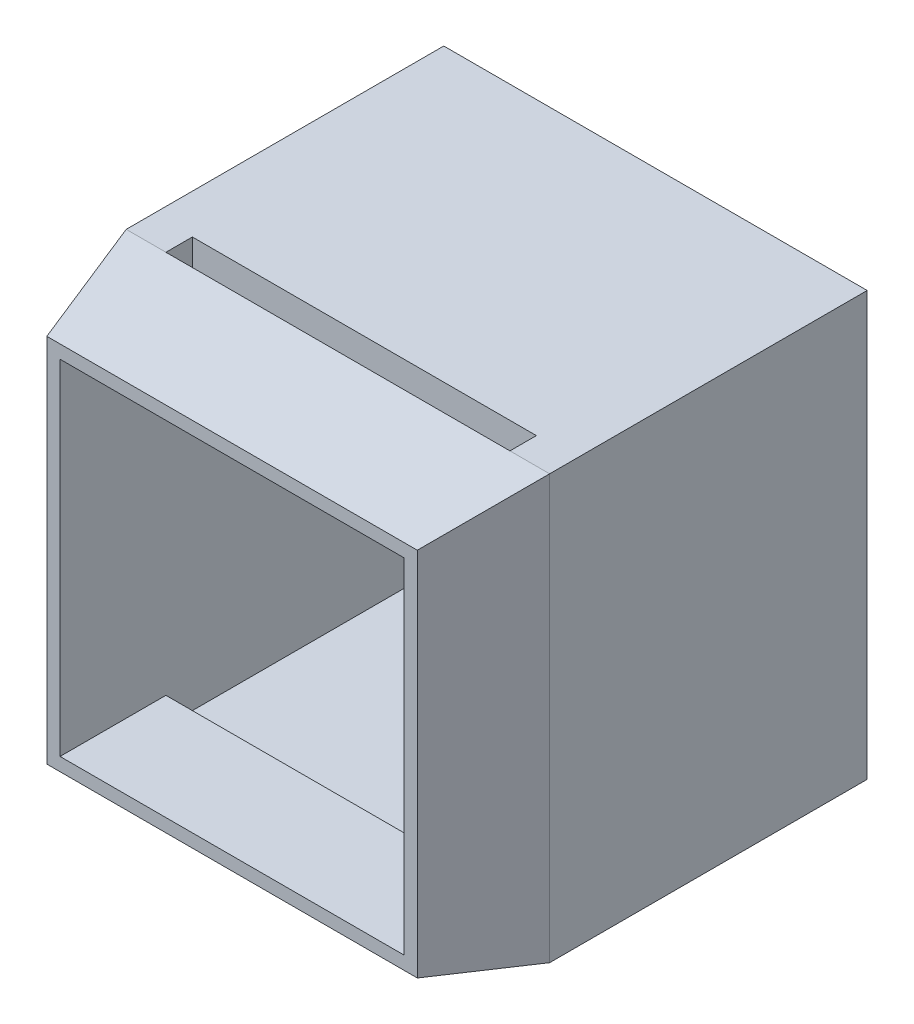
from build123d import *

# Parameters (mm, degrees)
SKETCH1_W               = 406.4
SKETCH1_H               = 406.4
BOSS_EXTRUDE1_DEPTH     = 304.8
CUT_EXTRUDE2_DEPTH      = 704.905448311
CUT_EXTRUDE2_DEPTH_BACK = 704.905448311
SKETCH6_W               = 330.2
SKETCH6_H               = 330.2
CUT_EXTRUDE3_DEPTH      = 704.905448369
CUT_EXTRUDE3_DEPTH_BACK = 704.905448369
SKETCH7_W               = 330.2
SKETCH7_H               = 25.4
SKETCH8_W               = 330.2
SKETCH8_H               = 279.4
CUT_EXTRUDE4_DEPTH      = 25.4


with BuildPart() as part:
    # Sketch1 → Boss-Extrude1 (new body)
    with BuildSketch(Plane.XY):
        with Locations((203.2, 203.2)):
            Rectangle(SKETCH1_W, SKETCH1_H)
    extrude(amount=BOSS_EXTRUDE1_DEPTH)

    # Sketch2 → section 1 of loft1
    with BuildSketch(Plane.XY.offset(406.4), mode=Mode.PRIVATE) as loft1_s1:
        with BuildLine():
            Line((25.4, 25.4), (381, 25.4))
            Line((381, 25.4), (381, 381))
            Line((381, 381), (25.4, 381))
            Line((25.4, 381), (25.4, 25.4))
        make_face()
    # loft from a face of the part (loft1)
    loft([part.faces().sort_by_distance((203.2, 203.2, 304.8))[0], loft1_s1.sketch])

    # Sketch6 → Cut-Extrude2 (cut, two sides: drawn at the far end of the back side and taken through both)
    with BuildSketch(Plane.XY.offset(406.4).offset(-CUT_EXTRUDE2_DEPTH_BACK)):
        with Locations((203.2, 203.2)):
            Rectangle(SKETCH6_W, SKETCH6_H)
    extrude(amount=CUT_EXTRUDE2_DEPTH + CUT_EXTRUDE2_DEPTH_BACK, mode=Mode.SUBTRACT)

    # Sketch7 → Cut-Extrude3 (cut, two sides: drawn at the far end of the back side and taken through both)
    with BuildSketch(Plane(origin=(0, 406.4, 0), x_dir=(1, 0, 0), z_dir=(0, 1, 0)).offset(-CUT_EXTRUDE3_DEPTH_BACK)):
        with Locations((203.2, -292.1)):
            Rectangle(SKETCH7_W, SKETCH7_H)
    extrude(amount=CUT_EXTRUDE3_DEPTH + CUT_EXTRUDE3_DEPTH_BACK, mode=Mode.SUBTRACT)

    # Sketch8 → Cut-Extrude4 (cut)
    with BuildSketch(Plane(origin=(0, 38.1, 0), x_dir=(1, 0, 0), z_dir=(0, 1, 0))):
        with Locations((203.2, -139.7)):
            Rectangle(SKETCH8_W, SKETCH8_H)
    extrude(amount=-CUT_EXTRUDE4_DEPTH, mode=Mode.SUBTRACT)


solid = part.part
